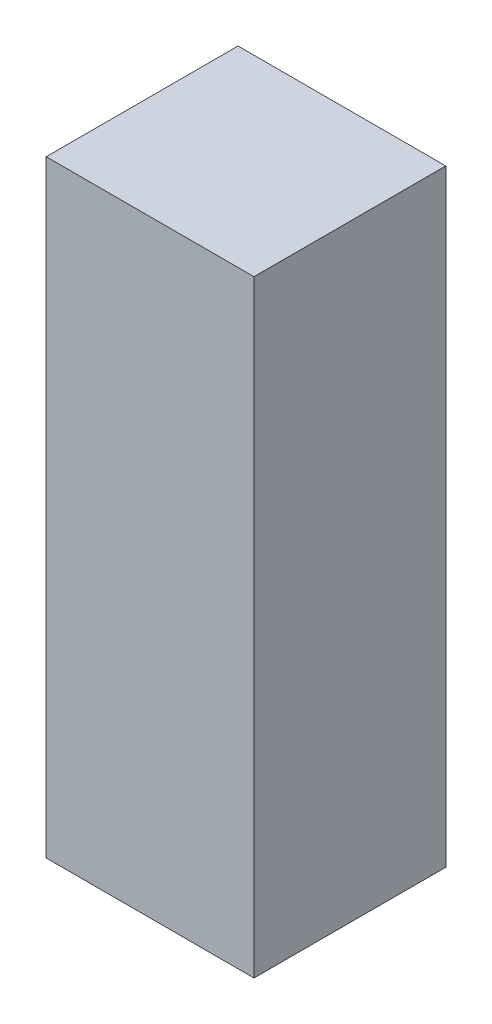
from build123d import *

# Parameters (mm, degrees)
SKETCH1_W           = 650
SKETCH1_H           = 600
BOSS_EXTRUDE1_DEPTH = 1900


with BuildPart() as part:
    # Sketch1 → Boss-Extrude1 (new body)
    with BuildSketch(Plane(origin=(0, 0, 0), x_dir=(1, 0, 0), z_dir=(0, 1, 0))):
        with Locations((325, -300)):
            Rectangle(SKETCH1_W, SKETCH1_H)
    extrude(amount=BOSS_EXTRUDE1_DEPTH)


solid = part.part
